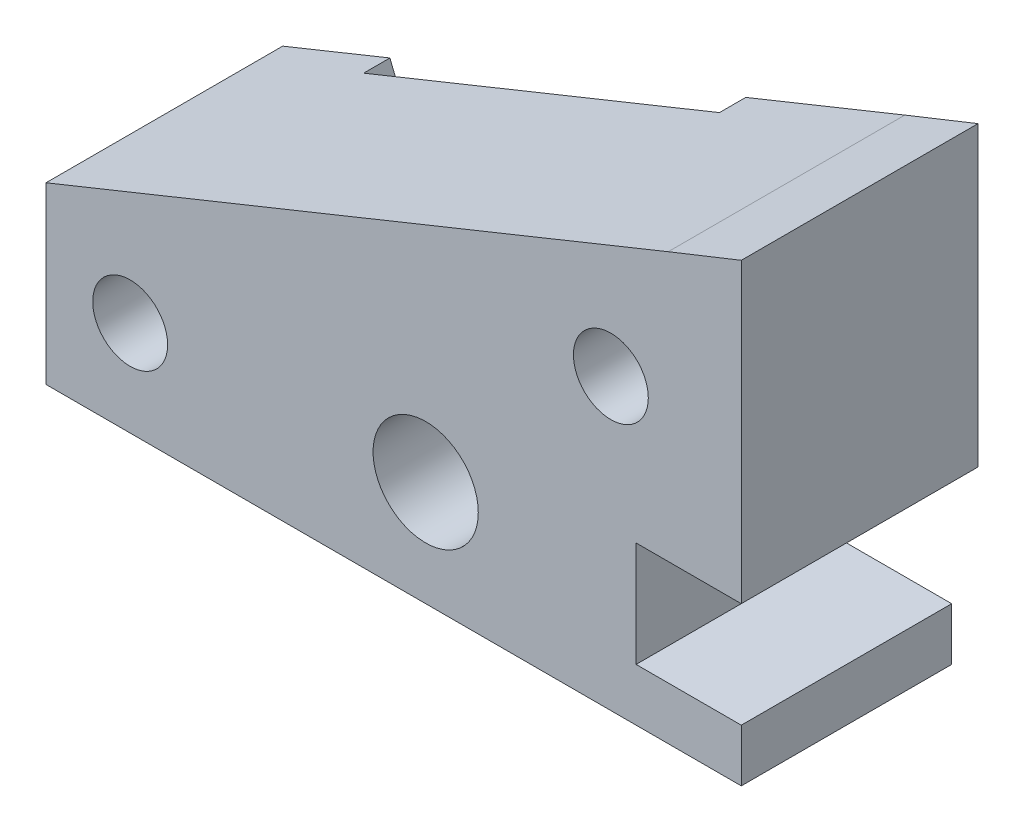
from build123d import *

# Parameters (mm, degrees)
SKETCH1_R           = 1.5875
SKETCH1_R_2         = 1.1303
BOSS_EXTRUDE1_DEPTH = 7.14375
SKETCH2_R           = 1.5875
CUT_EXTRUDE1_DEPTH  = 0.79375


with BuildPart() as part:
    # Sketch1 → Boss-Extrude1 (new body)
    with BuildSketch(Plane.XY):
        Polygon((6.35, 1.5875), (9.525, 1.5875), (9.525, 4.224628752), (9.525, 10.562648806), (7.319307862, 9.683908365), (-11.458663934, 2.097115291), (-11.458663934, -3.175), (9.525, -3.175), (9.525, -1.5875), (6.35, -1.5875), align=None)
        Circle(SKETCH1_R, mode=Mode.SUBTRACT)
        with Locations((-8.918663934, -0.301005903)):
            Circle(SKETCH1_R_2, mode=Mode.SUBTRACT)
        with Locations((5.588425528, 5.5602387)):
            Circle(SKETCH1_R_2, mode=Mode.SUBTRACT)
    extrude(amount=BOSS_EXTRUDE1_DEPTH)

    # Sketch2 → Cut-Extrude1 (cut)
    with BuildSketch(Plane.XY):
        with BuildLine():
            Line((9.525, 1.5875), (6.148361062, 1.5875))
            ThreePointArc((6.148361062, 1.5875), (5.169946467, 3.687025023), (3.503620258, 5.29595554))
            Line((3.503620258, 5.29595554), (2.515012001, 7.742846841))
            Line((2.515012001, 7.742846841), (-8.224002276, 3.404003433))
            Line((-8.224002276, 3.404003433), (-5.565912349, -3.175))
            Line((-5.565912349, -3.175), (9.525, -3.175))
            Line((9.525, -3.175), (9.525, 1.5875))
        make_face()
        Circle(SKETCH2_R, mode=Mode.SUBTRACT)
    extrude(amount=CUT_EXTRUDE1_DEPTH, mode=Mode.SUBTRACT)


solid = part.part
